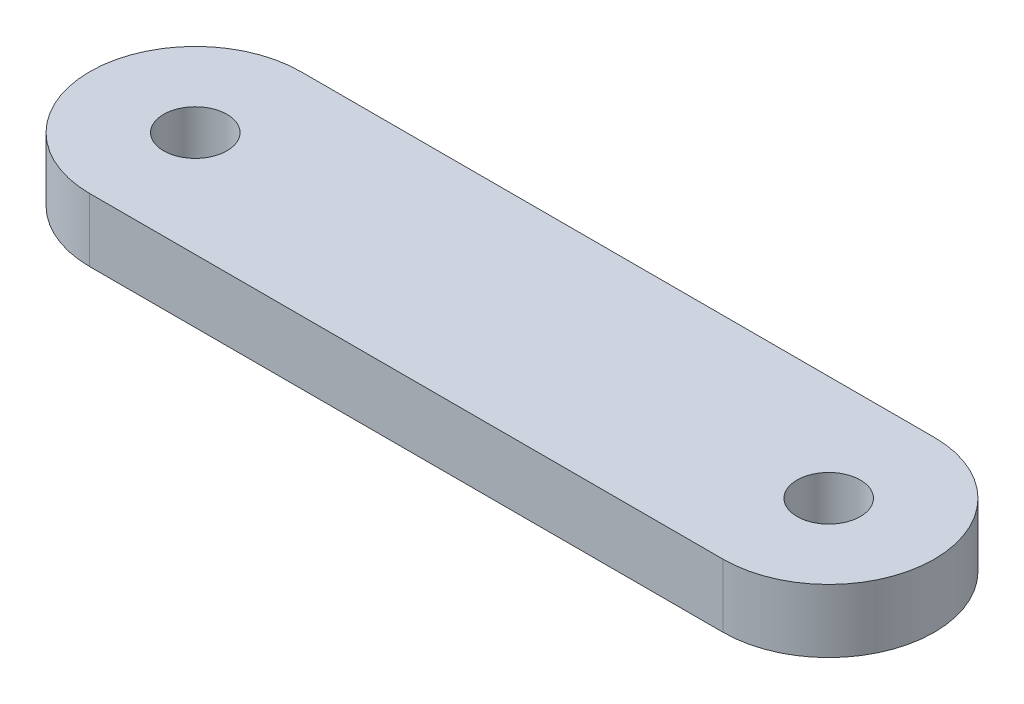
from build123d import *

# Parameters (mm, degrees)
EXTRUDE_1_DEPTH     = 3
SKETCH_2_R          = 1.5
CUT_EXTRUDE_1_DEPTH = 10


with BuildPart() as part:
    # 草图1 → 凸台-拉伸1 (new body)
    with BuildSketch(Plane(origin=(0, 0, 0), x_dir=(1, 0, 0), z_dir=(0, 1, 0))):
        with BuildLine():
            Line((-15, 5), (15, 5))
            ThreePointArc((15, 5), (20, 0), (15, -5))
            Line((15, -5), (-15, -5))
            ThreePointArc((-15, -5), (-20, 0), (-15, 5))
        make_face()
    extrude(amount=EXTRUDE_1_DEPTH)

    # 草图2 → 切除-拉伸1 (cut)
    with BuildSketch(Plane(origin=(0, 3, 0), x_dir=(1, 0, 0), z_dir=(0, 1, 0))):
        with Locations(Location((-15, 0, 0), (0, 0, 270))):
            Circle(SKETCH_2_R)
        with Locations(Location((15, 0, 0), (0, 0, 270))):
            Circle(SKETCH_2_R)
    extrude(amount=-CUT_EXTRUDE_1_DEPTH, mode=Mode.SUBTRACT)


solid = part.part
